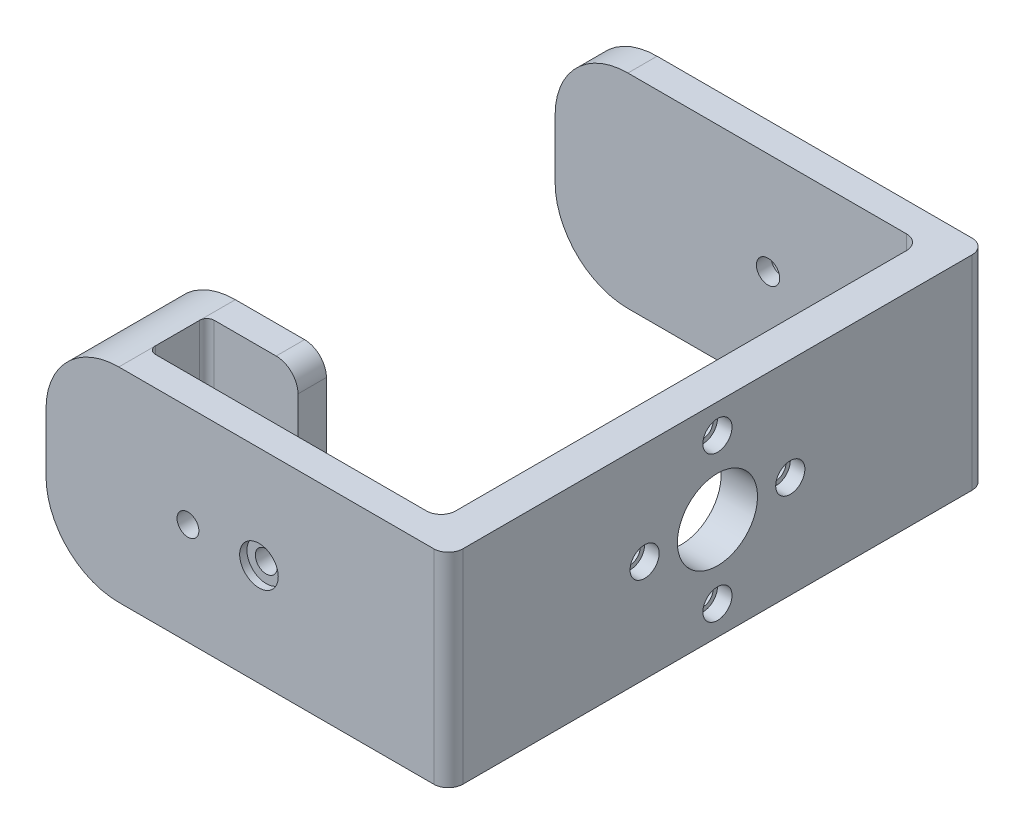
from build123d import *

# Parameters (mm, degrees)
BOSS_EXTRUDE1_DEPTH = 28
SKETCH2_R           = 1.4
SKETCH2_R_2         = 5.5
CUT_EXTRUDE1_DEPTH  = 69.361978468
CUT_EXTRUDE2_REACH  = 85.714
SKETCH3_R           = 1.5
CUT_EXTRUDE3_REACH  = 85.714
SKETCH4_R           = 1.6
SKETCH6_R           = 2
CUT_EXTRUDE5_DEPTH  = 2
SKETCH7_R           = 2.65
CUT_EXTRUDE6_DEPTH  = 2
FILLET1_R           = 10
FILLET2_R           = 2
BOSS_EXTRUDE2_DEPTH = 12
SKETCH10_W          = 3.9
SKETCH10_H          = 28
BOSS_EXTRUDE3_DEPTH = 12.5
CUT_EXTRUDE8_REACH  = 85.714
SKETCH8_R           = 1.5
CUT_EXTRUDE9_START  = -1.5
SKETCH11_R          = 2.75
SKETCH11_R_2        = 1.5
CUT_EXTRUDE9_DEPTH  = 1.5
FILLET3_R           = 3
FILLET4_R           = 1
SKETCH12_R          = 2.65
SKETCH12_R_2        = 1.5
CUT_EXTRUDE10_DEPTH = 1


with BuildPart() as part:
    # Sketch1 → Boss-Extrude1 (new body)
    with BuildSketch(Plane(origin=(0, 0, 0), x_dir=(1, 0, 0), z_dir=(0, 1, 0))):
        Polygon((-27.62, -36.95), (27.62, -36.95), (27.62, 36.95), (-27.62, 36.95), (-27.62, 32.95), (22.62, 32.95), (22.62, -32.95), (-27.62, -32.95), align=None)
    extrude(amount=BOSS_EXTRUDE1_DEPTH)

    # Sketch2 → Cut-Extrude1 (cut, through all)
    with BuildSketch(Plane.ZY.offset(-22.62)):
        with Locations((0, 4)):
            Circle(SKETCH2_R)
        with Locations((0, 24)):
            Circle(SKETCH2_R)
        with Locations((-10, 14)):
            Circle(SKETCH2_R)
        with Locations((10, 14)):
            Circle(SKETCH2_R)
        with Locations((0, 14)):
            Circle(SKETCH2_R_2)
    extrude(amount=-CUT_EXTRUDE1_DEPTH, mode=Mode.SUBTRACT)

    # Sketch3 → Cut-Extrude2 (cut, up to next)
    with BuildSketch(Plane.XY.offset(36.95), mode=Mode.PRIVATE) as cut_extrude2_sk1:
        with Locations((1.62, 14)):
            Circle(SKETCH3_R)
    cut_extrude2_tool1 = extrude(cut_extrude2_sk1.sketch, amount=-CUT_EXTRUDE2_REACH, mode=Mode.PRIVATE) & part.part
    add(cut_extrude2_tool1.solids().sort_by_distance((1.62, 14, 36.95))[0], mode=Mode.SUBTRACT)

    # Sketch4 → Cut-Extrude3 (cut, up to next)
    with BuildSketch(Plane(origin=(0, 0, -36.95), x_dir=(-1, 0, 0), z_dir=(0, 0, -1)), mode=Mode.PRIVATE) as cut_extrude3_sk1:
        with Locations((-1.62, 14)):
            Circle(SKETCH4_R)
    cut_extrude3_tool1 = extrude(cut_extrude3_sk1.sketch, amount=-CUT_EXTRUDE3_REACH, mode=Mode.PRIVATE) & part.part
    add(cut_extrude3_tool1.solids().sort_by_distance((1.62, 14, -36.95))[0], mode=Mode.SUBTRACT)

    # Sketch6 → Cut-Extrude5 (cut)
    with BuildSketch(Plane(origin=(27.62, 0, 0), x_dir=(0, 0, -1), z_dir=(1, 0, 0))):
        with Locations((0, 24)):
            Circle(SKETCH6_R)
        with Locations((10, 14)):
            Circle(SKETCH6_R)
        with Locations((0, 4)):
            Circle(SKETCH6_R)
        with Locations((-10, 14)):
            Circle(SKETCH6_R)
    extrude(amount=-CUT_EXTRUDE5_DEPTH, mode=Mode.SUBTRACT)

    # Sketch7 → Cut-Extrude6 (cut)
    with BuildSketch(Plane(origin=(0, 0, -36.95), x_dir=(-1, 0, 0), z_dir=(0, 0, -1))):
        with Locations((-1.62, 14)):
            Circle(SKETCH7_R)
    extrude(amount=-CUT_EXTRUDE6_DEPTH, mode=Mode.SUBTRACT)

    # Fillet1
    fillet1_edges = [part.edges().sort_by_distance(p)[0] for p in [
        (-27.62, 0, 34.95),
        (-27.62, 28, 34.95),
        (-27.62, 28, -34.95),
        (-27.62, 0, -34.95),
    ]]
    fillet(fillet1_edges, radius=FILLET1_R)

    # Fillet2
    fillet2_edges = [part.edges().sort_by_distance(p)[0] for p in [
        (27.62, 14, -36.95),
        (27.62, 14, 36.95),
        (22.62, 14, 32.95),
        (22.62, 14, -32.95),
    ]]
    fillet(fillet2_edges, radius=FILLET2_R)

    # Sketch9 → Boss-Extrude2 (add)
    with BuildSketch(Plane(origin=(0, 0, 32.95), x_dir=(-1, 0, 0), z_dir=(0, 0, -1))):
        with BuildLine():
            Line((17.62, 28), (17.62, 0))
            ThreePointArc((17.62, 0), (24.691067812, 2.928932188), (27.62, 10))
            Line((27.62, 10), (27.62, 18))
            ThreePointArc((27.62, 18), (24.691067812, 25.071067812), (17.62, 28))
        make_face()
    extrude(amount=BOSS_EXTRUDE2_DEPTH)

    # Sketch10 → Boss-Extrude3 (add)
    with BuildSketch(Plane(origin=(-17.62, 0, 0), x_dir=(0, 0, -1), z_dir=(1, 0, 0))):
        with Locations((-22.9, 14)):
            Rectangle(SKETCH10_W, SKETCH10_H)
    extrude(amount=BOSS_EXTRUDE3_DEPTH)

    # Cut-Extrude8: up to this face of the body (flat: up to its plane)
    cut_extrude8_end = Plane(part.part.faces().sort_by_distance((-15.710832536, 14, 20.95))[0])
    # Sketch8 → Cut-Extrude8 (cut, up to the picked face)
    with BuildSketch(Plane.XY.offset(36.95), mode=Mode.PRIVATE) as cut_extrude8_sk1:
        with Locations(Location((-8.13, 14, 0), (0, 0, 90))):
            Circle(SKETCH8_R)
    cut_extrude8_tool1 = split(extrude(cut_extrude8_sk1.sketch, amount=-CUT_EXTRUDE8_REACH, mode=Mode.PRIVATE), bisect_by=cut_extrude8_end, keep=Keep.BOTH, mode=Mode.PRIVATE)
    add(cut_extrude8_tool1.solids().sort_by(Axis((-8.13, 14, 36.95), (0, 0, -1)))[0], mode=Mode.SUBTRACT)

    # Sketch11 → Cut-Extrude9 (cut)
    with BuildSketch(Plane(origin=(0, 0, 20.95), x_dir=(-1, 0, 0), z_dir=(0, 0, -1)).offset(CUT_EXTRUDE9_START)):
        with Locations((8.13, 14)):
            Circle(SKETCH11_R)
        with Locations(Location((8.13, 14, 0), (0, 0, 90))):
            Circle(SKETCH11_R_2, mode=Mode.SUBTRACT)
    extrude(amount=CUT_EXTRUDE9_DEPTH, mode=Mode.SUBTRACT)

    # Fillet3
    fillet3_edges = [part.edges().sort_by_distance(p)[0] for p in [
        (-5.12, 0, 22.9),
        (-5.12, 28, 22.9),
    ]]
    fillet(fillet3_edges, radius=FILLET3_R)

    # Fillet4
    fillet4_edges = [part.edges().sort_by_distance(p)[0] for p in [
        (-17.62, 14, 32.95),
        (-17.62, 14, 24.85),
    ]]
    fillet(fillet4_edges, radius=FILLET4_R)

    # Sketch12 → Cut-Extrude10 (cut)
    with BuildSketch(Plane.XY.offset(36.95)):
        with Locations(Location((1.62, 14, 0), (0, 0, 180))):
            Circle(SKETCH12_R)
        with Locations((1.62, 14)):
            Circle(SKETCH12_R_2, mode=Mode.SUBTRACT)
    extrude(amount=-CUT_EXTRUDE10_DEPTH, mode=Mode.SUBTRACT)


solid = part.part
